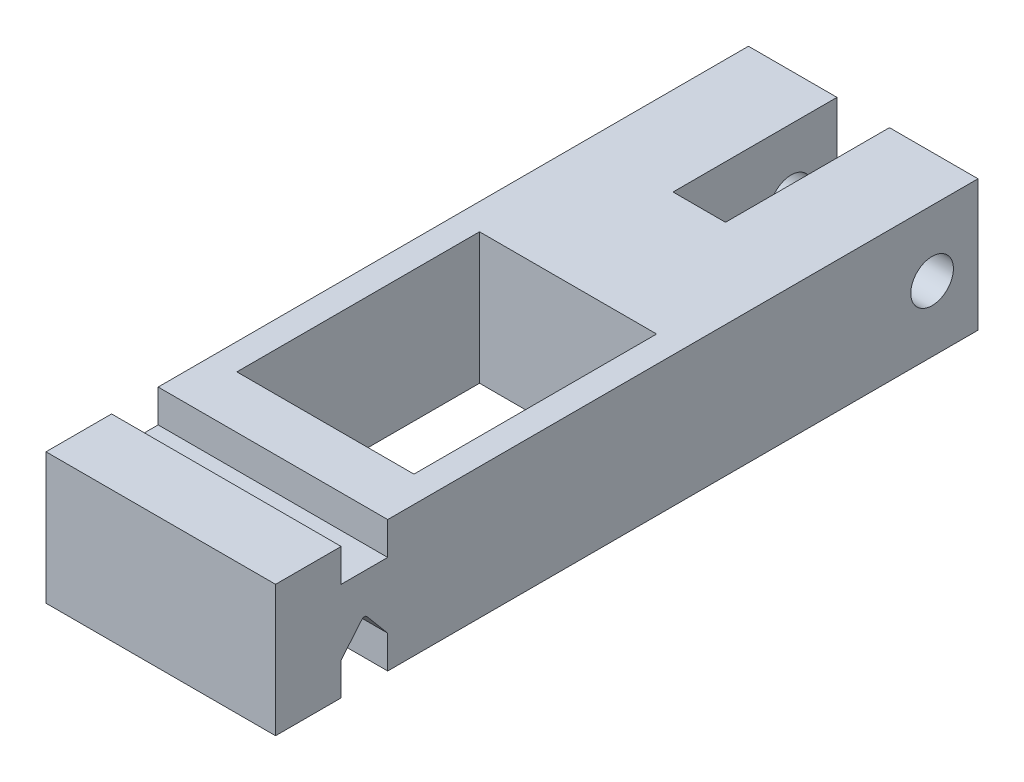
from build123d import *

# Parameters (mm, degrees)
CROQUIS1_R              = 3.25
SALIENTE_EXTRUIR1_DEPTH = 35
CORTAR_EXTRUIR1_REACH   = 116.435
CROQUIS2_W              = 8
CROQUIS2_H              = 25
REDONDEO1_R             = 0.5
CROQUIS4_W              = 27
CROQUIS4_H              = 37
CORTAR_EXTRUIR2_DEPTH   = 115.435178158


with BuildPart() as part:
    # Croquis1 → Saliente-Extruir1 (new body)
    with BuildSketch(Plane(origin=(0, 0, 0), x_dir=(0, 0, -1), z_dir=(1, 0, 0))):
        Polygon((0, 10), (0, -10), (10, -10), (10, -5), (13.55, -0.769274746), (17.1, -5), (17.1, -10), (107.1, -10), (107.1, 10), (17.1, 10), (17.1, 5), (10, 5), (10, 10), align=None)
        with Locations((100.1, 0)):
            Circle(CROQUIS1_R, mode=Mode.SUBTRACT)
    extrude(amount=SALIENTE_EXTRUIR1_DEPTH)

    # Croquis2 → Cortar-Extruir1 (cut, up to next)
    with BuildSketch(Plane(origin=(0, 10, 0), x_dir=(1, 0, 0), z_dir=(0, 1, 0)), mode=Mode.PRIVATE) as cortar_extruir1_sk1:
        with Locations((17.5, 94.6)):
            Rectangle(CROQUIS2_W, CROQUIS2_H)
    cortar_extruir1_tool1 = extrude(cortar_extruir1_sk1.sketch, amount=-CORTAR_EXTRUIR1_REACH, mode=Mode.PRIVATE) & part.part
    add(cortar_extruir1_tool1.solids().sort_by_distance((17.5, 10, -94.6))[0], mode=Mode.SUBTRACT)

    # Redondeo1
    redondeo1_edges = [part.edges().sort_by_distance(p)[0] for p in [
        (17.5, -0.769274746, -13.55),
    ]]
    fillet(redondeo1_edges, radius=REDONDEO1_R)

    # Croquis4 → Cortar-Extruir2 (cut, through all)
    with BuildSketch(Plane(origin=(0, 10, 0), x_dir=(1, 0, 0), z_dir=(0, 1, 0))):
        with Locations((17.5, 43.6)):
            Rectangle(CROQUIS4_W, CROQUIS4_H)
    extrude(amount=-CORTAR_EXTRUIR2_DEPTH, mode=Mode.SUBTRACT)


solid = part.part
